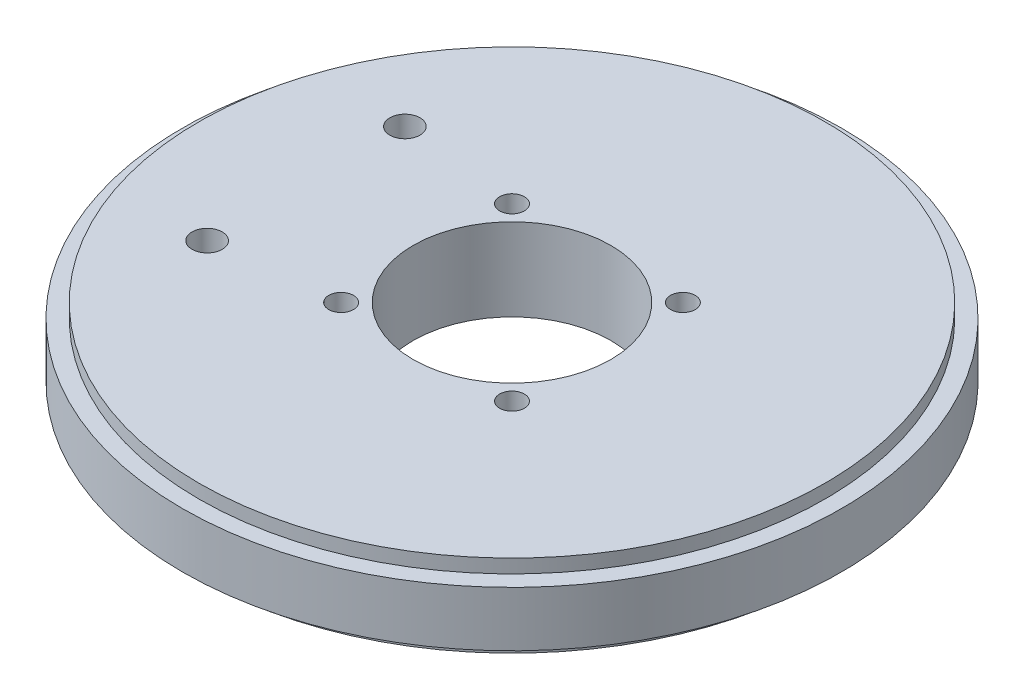
from build123d import *

# Parameters (mm, degrees)
SKETCH1_R                  = 57
EXTRUDE4_DEPTH             = 7.5
SKETCH_R                   = 60
SKETCH_R_2                 = 57
EXTRUDE5_DEPTH             = 5
EXTRUDE6_DEPTH             = 86.183625187
EXTRUDE6_DEPTH_BACK        = 86.183625187
SKETCH5_R                  = 18
F_4_5_4_5_DIAMETER_HOLE1_D = 4.5
CIRPATTERN1_COUNT          = 4
M5_CLEARANCE_HOLE1_D       = 5.5


with BuildPart() as part:
    # Sketch1 → Extrude4 (new, symmetric)
    with BuildSketch(Plane(origin=(0, 0, 0), x_dir=(1, 0, 0), z_dir=(0, 1, 0))):
        Circle(SKETCH1_R)
    extrude(amount=EXTRUDE4_DEPTH, both=True)

    # Sketch → Extrude5 (add, symmetric)
    with BuildSketch(Plane(origin=(0, 0, 0), x_dir=(1, 0, 0), z_dir=(0, 1, 0))):
        Circle(SKETCH_R)
        Circle(SKETCH_R_2, mode=Mode.SUBTRACT)
    extrude(amount=EXTRUDE5_DEPTH, both=True)

    # Sketch5 → Extrude6 (cut, two sides: drawn at the far end of the back side and taken through both)
    with BuildSketch(Plane(origin=(0, 0, 0), x_dir=(1, 0, 0), z_dir=(0, 1, 0)).offset(-EXTRUDE6_DEPTH_BACK)):
        Circle(SKETCH5_R)
    extrude(amount=EXTRUDE6_DEPTH + EXTRUDE6_DEPTH_BACK, mode=Mode.SUBTRACT)

    # Ø4.5 (4.5) Diameter Hole1 (through all)
    with Locations(Plane(origin=(0, -7.5, 0), x_dir=(-1, 0, 0), z_dir=(0, -1, 0))):
        with Locations((15.556349186, 15.556349186)):
            f_4_5_4_5_diameter_hole1 = Hole(F_4_5_4_5_DIAMETER_HOLE1_D / 2)

    # CirPattern1: Ø4.5 (4.5) Diameter Hole1 ×4 about axis
    cirpattern1_axis = Axis((0, -8.25, 0), (0, 1, 0))
    for i in range(1, CIRPATTERN1_COUNT):
        add(f_4_5_4_5_diameter_hole1.rotate(cirpattern1_axis, i * 360 / CIRPATTERN1_COUNT), mode=Mode.SUBTRACT)

    # M5 Clearance Hole1 (through all)
    with Locations(Plane(origin=(0, 7.5, 0), x_dir=(1, 0, 0), z_dir=(0, 1, 0))):
        with Locations((-37.5, 18), (-37.5, -18)):
            Hole(M5_CLEARANCE_HOLE1_D / 2)


solid = part.part
